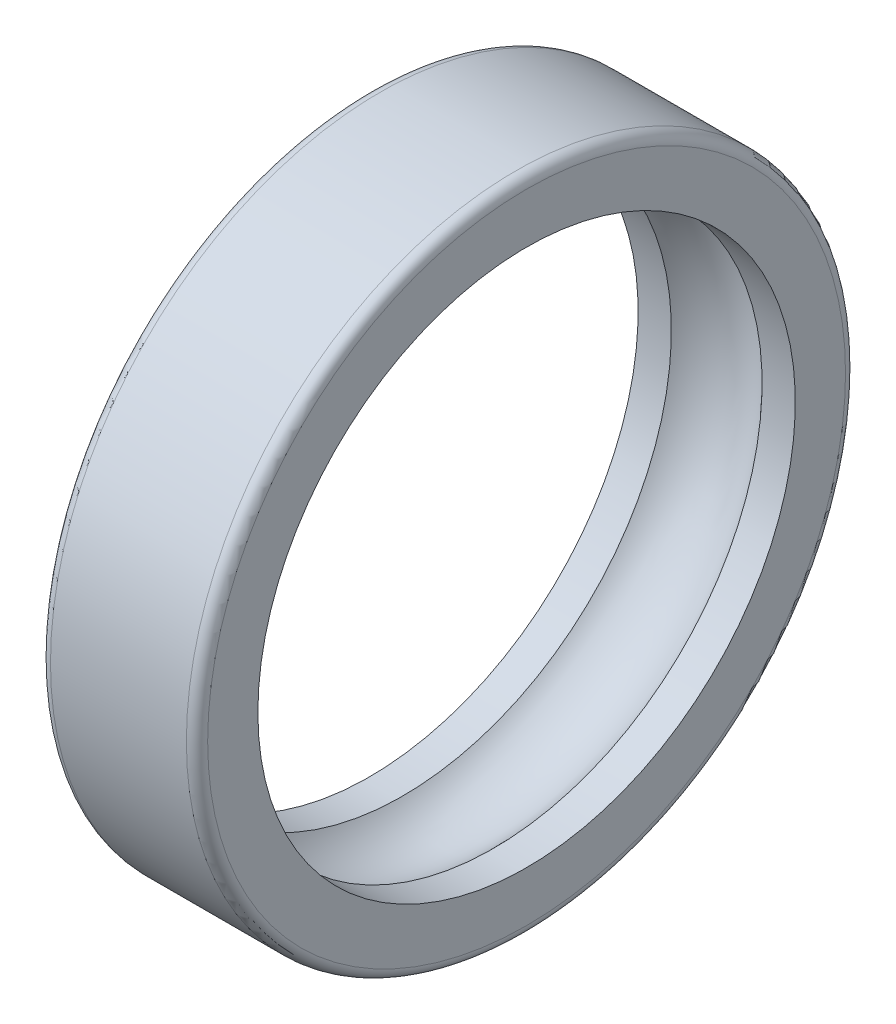
from build123d import *

# Parameters (mm, degrees)
CONG_1_R = 2.1


with BuildPart() as part:
    # Esquisse2 → Révolution1 (revolve)
    with BuildSketch(Plane.XY, mode=Mode.PRIVATE) as r_volution1_sk:
        with BuildLine():
            Line((-15.5, 53), (-8.94427191, 53))
            ThreePointArc((-8.94427191, 53), (0, 57), (8.94427191, 53))
            Line((8.94427191, 53), (15.5, 53))
            Line((15.5, 53), (15.5, 65))
            Line((15.5, 65), (-15.5, 65))
            Line((-15.5, 65), (-15.5, 53))
        make_face()
    revolve(r_volution1_sk.sketch.rotate(Axis((-31.364762171, 0, 0), (1, 0, 0)), 90), axis=Axis((-31.364762171, 0, 0), (1, 0, 0)))

    # Congé1
    cong_1_edges = [part.edges().sort_by_distance(p)[0] for p in [
        (15.5, 0, -65),
        (-15.5, 0, -65),
    ]]
    fillet(cong_1_edges, radius=CONG_1_R)


solid = part.part
